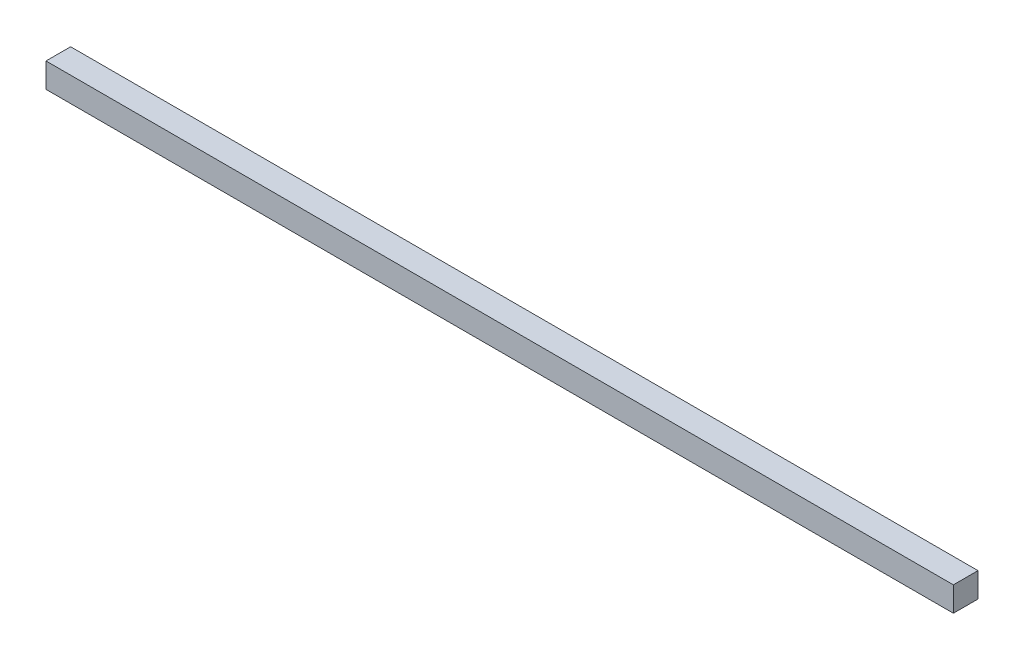
from build123d import *

# Parameters (mm, degrees)
SKETCH1_W               = 740
SKETCH1_H               = 20
BOSS_EXTRUDE1_DEPTH     = 20
CUT_EXTRUDE1_DEPTH      = 741.540343263
CUT_EXTRUDE1_DEPTH_BACK = 741.540343263
SKETCH2_W               = 3
SKETCH2_H               = 20


with BuildPart() as part:
    # Sketch1 → Boss-Extrude1 (new body)
    with BuildSketch(Plane.XY):
        with Locations((370, 10)):
            Rectangle(SKETCH1_W, SKETCH1_H)
    extrude(amount=BOSS_EXTRUDE1_DEPTH)

    # Sketch2 → Cut-Extrude1 (cut, two sides: drawn at the far end of the back side and taken through both)
    with BuildSketch(Plane.XY.offset(20).offset(-CUT_EXTRUDE1_DEPTH_BACK)):
        with Locations((738.5, 10)):
            Rectangle(SKETCH2_W, SKETCH2_H)
    extrude(amount=CUT_EXTRUDE1_DEPTH + CUT_EXTRUDE1_DEPTH_BACK, mode=Mode.SUBTRACT)


solid = part.part
